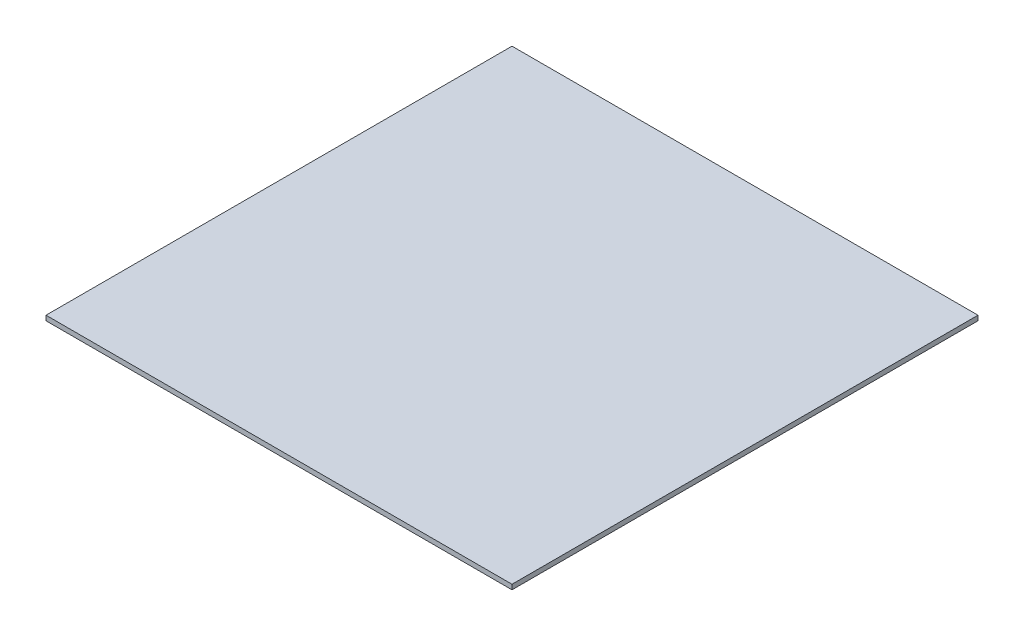
from build123d import *

# Parameters (mm, degrees)
SKETCH1_W           = 1219.2
SKETCH1_H           = 1219.2
BOSS_EXTRUDE1_DEPTH = 12.7


with BuildPart() as part:
    # Sketch1 → Boss-Extrude1 (new body)
    with BuildSketch(Plane(origin=(0, 0, 0), x_dir=(1, 0, 0), z_dir=(0, 1, 0))):
        Rectangle(SKETCH1_W, SKETCH1_H)
    extrude(amount=BOSS_EXTRUDE1_DEPTH)


solid = part.part
